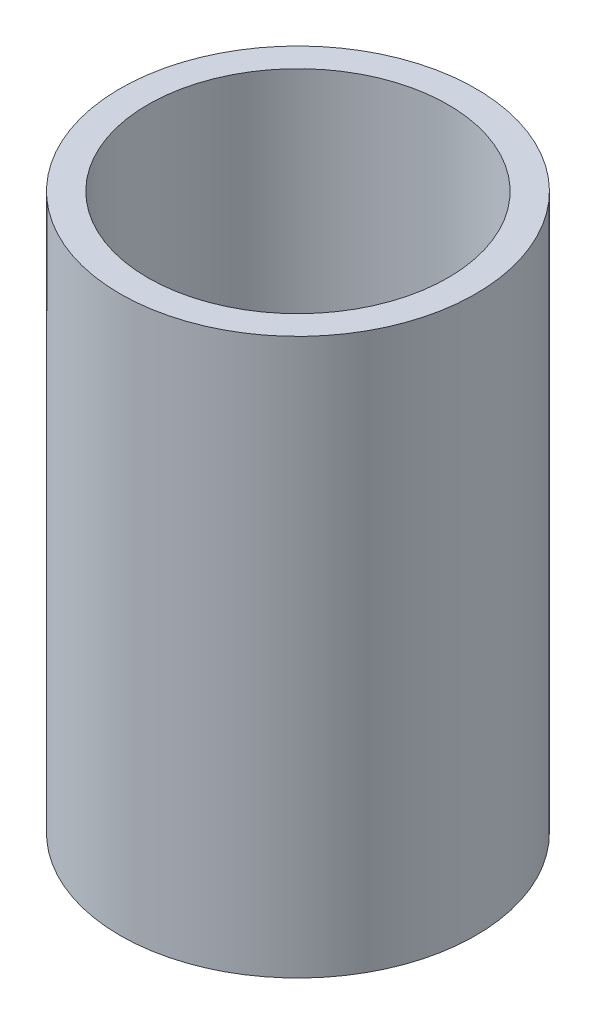
from build123d import *

# Parameters (mm, degrees)
SKETCH1_R           = 32
BOSS_EXTRUDE1_DEPTH = 100
SKETCH2_R           = 27
CUT_EXTRUDE1_DEPTH  = 85
SKETCH3_W           = 28
SKETCH3_H           = 28
CUT_EXTRUDE2_DEPTH  = 25


with BuildPart() as part:
    # Sketch1 → Boss-Extrude1 (new body)
    with BuildSketch(Plane(origin=(0, 0, 0), x_dir=(1, 0, 0), z_dir=(0, 1, 0))):
        with Locations(Location((0, 0, 0), (0, 0, 270))):
            Circle(SKETCH1_R)
    extrude(amount=BOSS_EXTRUDE1_DEPTH)

    # Sketch2 → Cut-Extrude1 (cut)
    with BuildSketch(Plane(origin=(0, 100, 0), x_dir=(1, 0, 0), z_dir=(0, 1, 0))):
        with Locations(Location((0, 0, 0), (0, 0, 270))):
            Circle(SKETCH2_R)
    extrude(amount=-CUT_EXTRUDE1_DEPTH, mode=Mode.SUBTRACT)

    # Sketch3 → Cut-Extrude2 (cut)
    with BuildSketch(Plane.XZ):
        Rectangle(SKETCH3_W, SKETCH3_H)
    extrude(amount=-CUT_EXTRUDE2_DEPTH, mode=Mode.SUBTRACT)


solid = part.part
